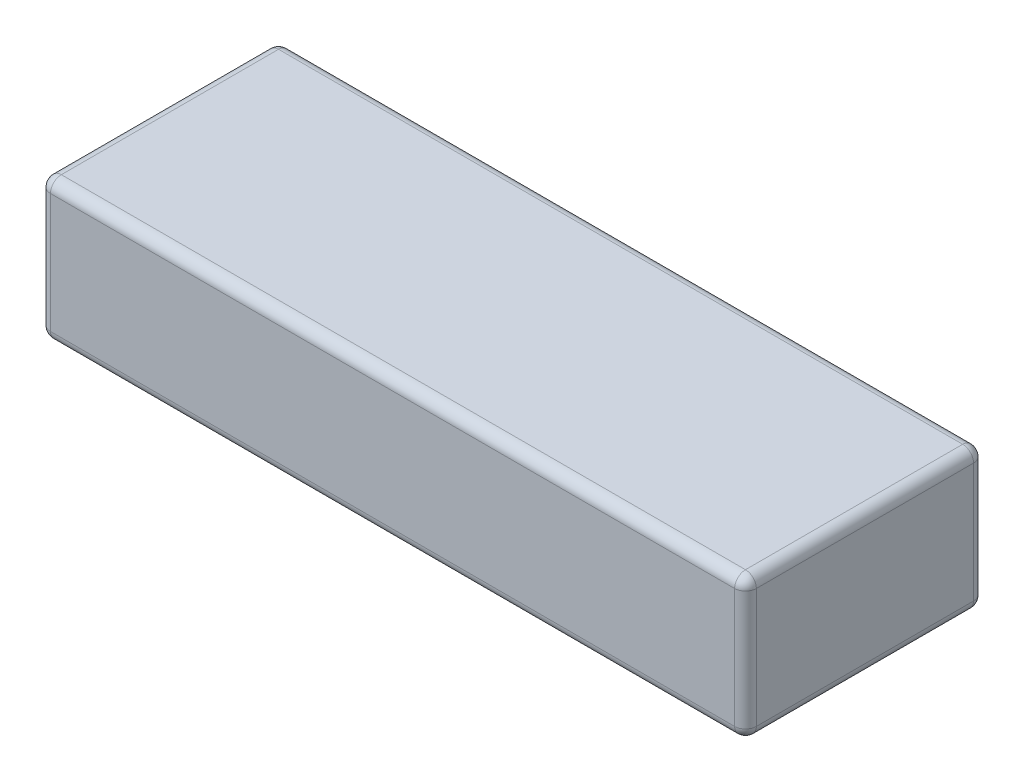
from build123d import *

# Parameters (mm, degrees)
SKETCH1_W           = 130
SKETCH1_H           = 44
BOSS_EXTRUDE1_DEPTH = 26
FILLET1_R           = 2


with BuildPart() as part:
    # Sketch1 → Boss-Extrude1 (new body)
    with BuildSketch(Plane(origin=(0, 0, 0), x_dir=(1, 0, 0), z_dir=(0, 1, 0))):
        with Locations((3.207236842, 5.429276316)):
            Rectangle(SKETCH1_W, SKETCH1_H)
    extrude(amount=BOSS_EXTRUDE1_DEPTH)

    # Fillet1
    fillet1_edges = [part.edges().sort_by_distance(p)[0] for p in [
        (68.207236842, 26, -5.429276316),
        (3.207236842, 26, -27.429276316),
        (-61.792763158, 26, -5.429276316),
        (3.207236842, 0, -27.429276316),
        (68.207236842, 0, -5.429276316),
        (3.207236842, 0, 16.570723684),
        (-61.792763158, 0, -5.429276316),
        (-61.792763158, 13, -27.429276316),
        (68.207236842, 13, -27.429276316),
        (68.207236842, 13, 16.570723684),
        (-61.792763158, 13, 16.570723684),
        (3.207236842, 26, 16.570723684),
    ]]
    fillet(fillet1_edges, radius=FILLET1_R)


solid = part.part
